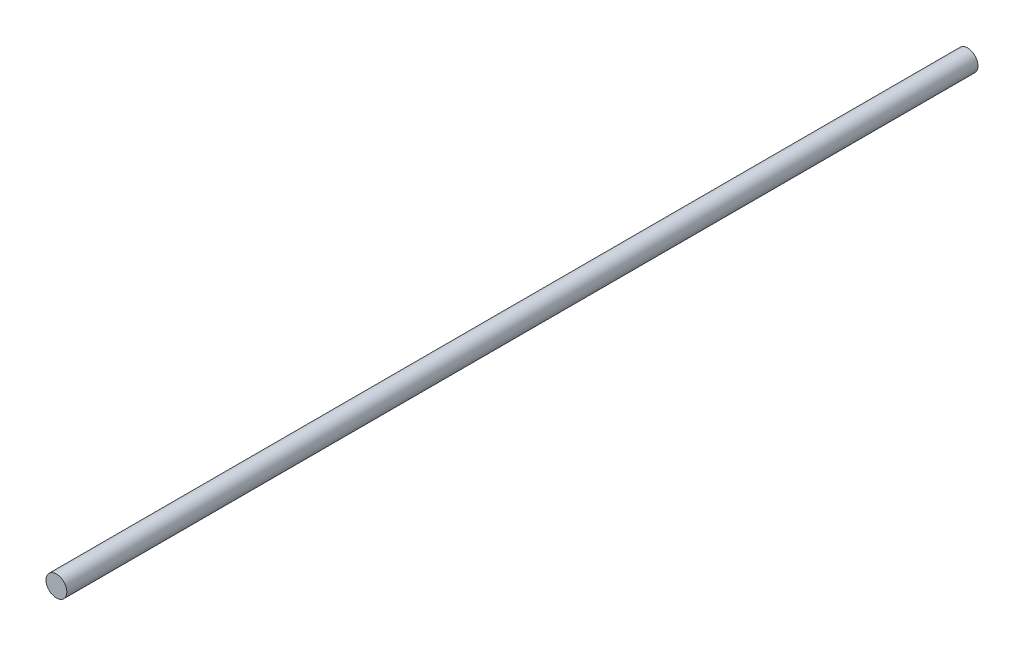
from build123d import *

# Parameters (mm, degrees)
SKICA1_R                = 4
P_IDAT_VYSUNUT_M1_DEPTH = 350


with BuildPart() as part:
    # Skica1 → Přidat vysunutím1 (new body)
    with BuildSketch(Plane.XY):
        Circle(SKICA1_R)
    extrude(amount=P_IDAT_VYSUNUT_M1_DEPTH)


solid = part.part
